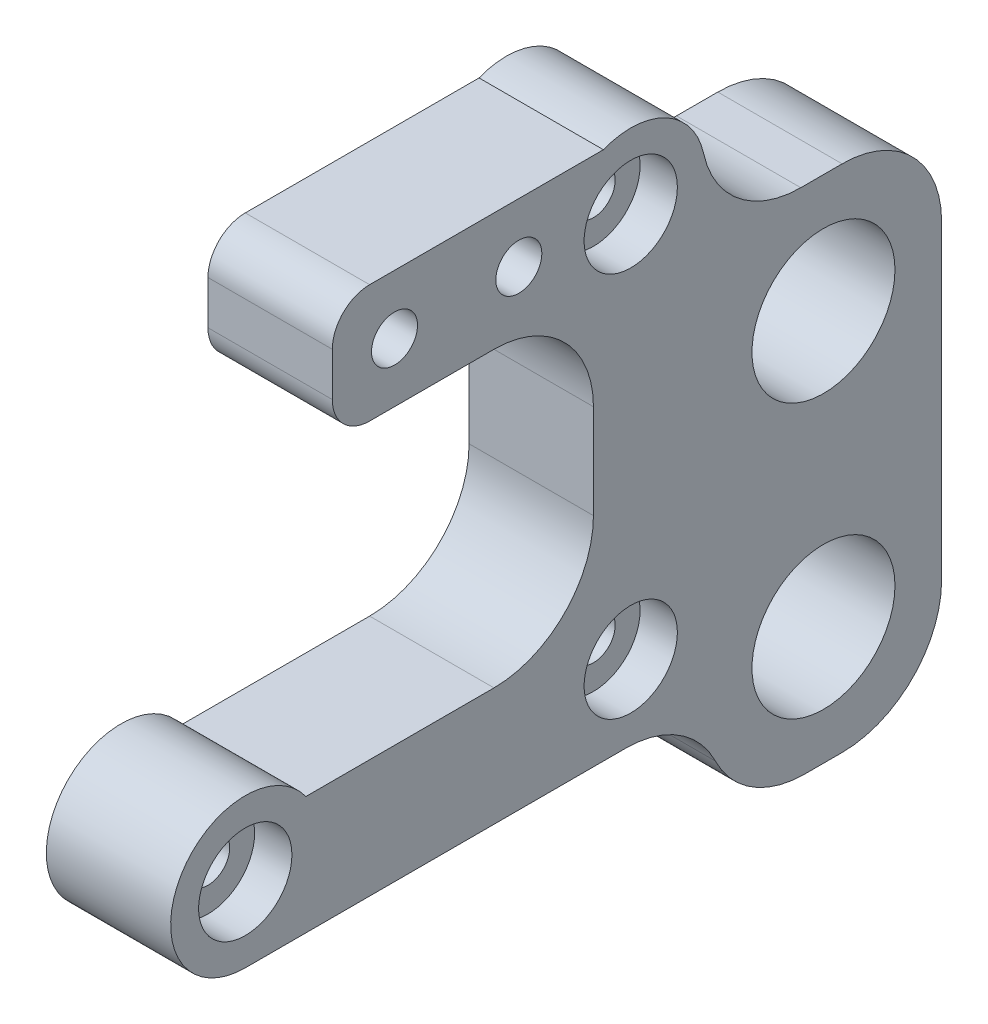
from build123d import *

# Parameters (mm, degrees)
SKETCH1_R           = 1.75
SKETCH1_R_2         = 5.75
BOSS_EXTRUDE3_DEPTH = 10
FILLET1_R           = 8
SKETCH6_R           = 3.75
CUT_EXTRUDE2_DEPTH  = 3
FILLET2_R           = 8
FILLET3_R           = 3
SKETCH8_R           = 1.85
CUT_EXTRUDE3_DEPTH  = 69.282336686
SKETCH9_R           = 3.75
CUT_EXTRUDE4_DEPTH  = 4


with BuildPart() as part:
    # Sketch1 → Boss-Extrude3 (new body)
    with BuildSketch(Plane(origin=(20, 0, 0), x_dir=(0, 0, -1), z_dir=(1, 0, 0))):
        with BuildLine():
            Line((-17.699617141, 42.082180663), (-39.499785546, 42.082180663))
            Line((-39.499785546, 42.082180663), (-39.499785546, 32.582180663))
            Line((-39.499785546, 32.582180663), (-18.499785546, 32.582180663))
            Line((-18.499785546, 32.582180663), (-18.499785546, 9))
            Line((-18.499785546, 9), (-41.626388373, 9))
            ThreePointArc((-41.626388373, 9), (-51.838324672, 8.238612788), (-46.499785546, -0.5))
            Line((-46.499785546, -0.5), (-9.499785546, -0.5))
            Line((-9.499785546, -0.5), (-9.499785546, -9.5))
            Line((-9.499785546, -9.5), (9.500214454, -9.5))
            Line((9.500214454, -9.5), (9.500214454, 31.5))
            Line((9.500214454, 31.5), (-9.499785546, 31.5))
            Line((-9.499785546, 31.5), (-9.499785546, 36.5))
            ThreePointArc((-9.499785546, 36.5), (-12.123322128, 41.459787776), (-17.699617141, 42.082180663))
        make_face()
        with Locations((-15.499785546, 36.5)):
            Circle(SKETCH1_R, mode=Mode.SUBTRACT)
        with Locations((0.000214454, 22)):
            Circle(SKETCH1_R_2, mode=Mode.SUBTRACT)
        with Locations((0.000214454, 0)):
            Circle(SKETCH1_R_2, mode=Mode.SUBTRACT)
        with Locations((-15.499785546, 5.5)):
            Circle(SKETCH1_R, mode=Mode.SUBTRACT)
        with Locations((-46.499785546, 5.5)):
            Circle(SKETCH1_R, mode=Mode.SUBTRACT)
    extrude(amount=BOSS_EXTRUDE3_DEPTH)

    # Fillet1
    fillet1_edges = [part.edges().sort_by_distance(p)[0] for p in [
        (25, -9.5, 9.499785546),
        (25, -9.5, -9.500214454),
        (25, 31.5, -9.500214454),
        (25, 9, 18.499785546),
        (25, 31.5, 9.499785546),
        (25, 32.582180663, 18.499785546),
    ]]
    fillet(fillet1_edges, radius=FILLET1_R)

    # Sketch6 → Cut-Extrude2 (cut)
    with BuildSketch(Plane(origin=(30, 0, 0), x_dir=(0, 0, -1), z_dir=(1, 0, 0))):
        with Locations((-15.499785546, 36.5)):
            Circle(SKETCH6_R)
        with Locations((-15.499785546, 5.5)):
            Circle(SKETCH6_R)
        with Locations((-46.499785546, 5.5)):
            Circle(SKETCH6_R)
    extrude(amount=-CUT_EXTRUDE2_DEPTH, mode=Mode.SUBTRACT)

    # Fillet2
    fillet2_edges = [part.edges().sort_by_distance(p)[0] for p in [
        (25, -0.5, 9.499785546),
    ]]
    fillet(fillet2_edges, radius=FILLET2_R)

    # Fillet3
    fillet3_edges = [part.edges().sort_by_distance(p)[0] for p in [
        (25, 32.582180663, 39.499785546),
        (25, 42.082180663, 39.499785546),
    ]]
    fillet(fillet3_edges, radius=FILLET3_R)

    # Sketch8 → Cut-Extrude3 (cut, through all)
    with BuildSketch(Plane(origin=(30, 0, 0), x_dir=(0, 0, -1), z_dir=(1, 0, 0))):
        with Locations((-34.499785546, 37.332180663)):
            Circle(SKETCH8_R)
        with Locations((-24.499785546, 37.332180663)):
            Circle(SKETCH8_R)
    extrude(amount=-CUT_EXTRUDE3_DEPTH, mode=Mode.SUBTRACT)

    # Sketch9 → Cut-Extrude4 (cut)
    with BuildSketch(Plane.ZY.offset(-20)):
        with Locations((24.499785546, 37.332180663)):
            Circle(SKETCH9_R)
        with Locations((34.499785546, 37.332180663)):
            Circle(SKETCH9_R)
    extrude(amount=-CUT_EXTRUDE4_DEPTH, mode=Mode.SUBTRACT)


solid = part.part
